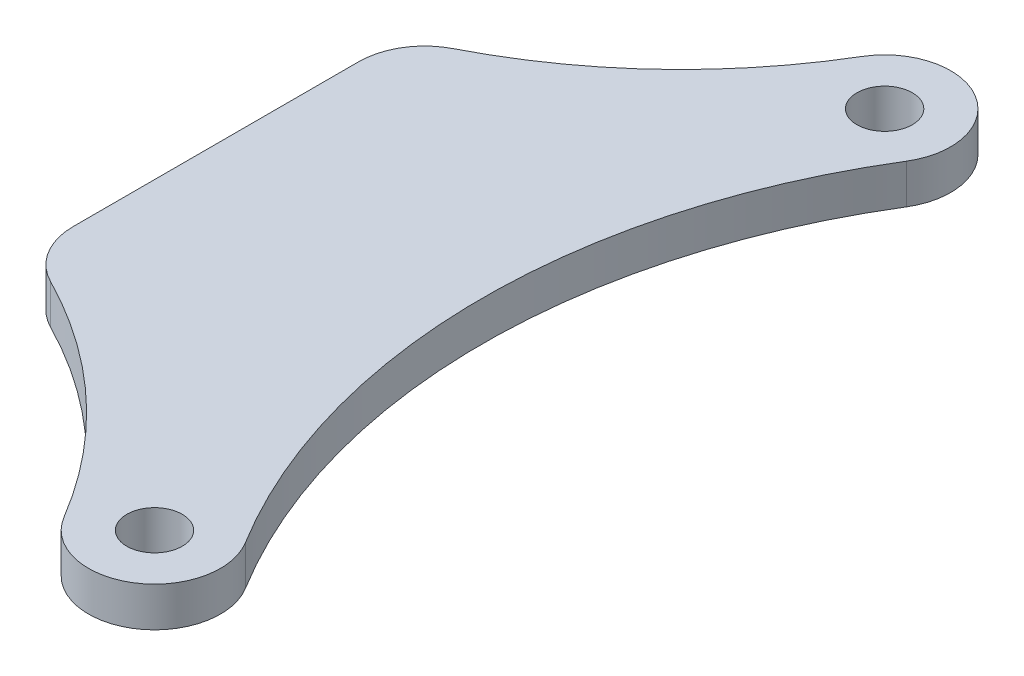
from build123d import *

# Parameters (mm, degrees)
SKETCH1_R           = 5
SKETCH1_R_2         = 2.1
BOSS_EXTRUDE1_DEPTH = 3
FILLET1_R           = 5


with BuildPart() as part:
    # Sketch1 → Boss-Extrude1 (new body)
    # profile 1 of 3: a face of its own
    with BuildSketch(Plane(origin=(0, 0, 0), x_dir=(1, 0, 0), z_dir=(0, 1, 0))):
        with BuildLine():
            Line((0, 14), (0, -14))
            ThreePointArc((0, -14), (10.659672329, -20.591511651), (18.703056171, -30.202995218))
            ThreePointArc((18.703056171, -30.202995218), (20.412961628, -23.367686313), (27.260231116, -25.029048724))
            ThreePointArc((27.260231116, -25.029048724), (20.185963894, 0), (27.260231116, 25.029048724))
            ThreePointArc((27.260231116, 25.029048724), (20.412961628, 23.367686313), (18.703056171, 30.202995218))
            ThreePointArc((18.703056171, 30.202995218), (10.659672329, 20.591511651), (0, 14))
        make_face()
    # profile 2 of 3: a face of its own
    with BuildSketch(Plane(origin=(0, 0, 0), x_dir=(1, 0, 0), z_dir=(0, 1, 0))):
        with Locations((23, -27.646381495)):
            Circle(SKETCH1_R)
        with Locations(Location((23, -27.646381495, 0), (0, 0, 270))):
            Circle(SKETCH1_R_2, mode=Mode.SUBTRACT)
    # profile 3 of 3: a face of its own
    with BuildSketch(Plane(origin=(0, 0, 0), x_dir=(1, 0, 0), z_dir=(0, 1, 0))):
        with Locations((23, 27.646381495)):
            Circle(SKETCH1_R)
        with Locations(Location((23, 27.646381495, 0), (0, 0, 270))):
            Circle(SKETCH1_R_2, mode=Mode.SUBTRACT)
    extrude(amount=BOSS_EXTRUDE1_DEPTH)

    # Fillet1
    fillet1_edges = [part.edges().sort_by_distance(p)[0] for p in [
        (0, 1.5, 14),
        (0, 1.5, -14),
    ]]
    fillet(fillet1_edges, radius=FILLET1_R)


solid = part.part
